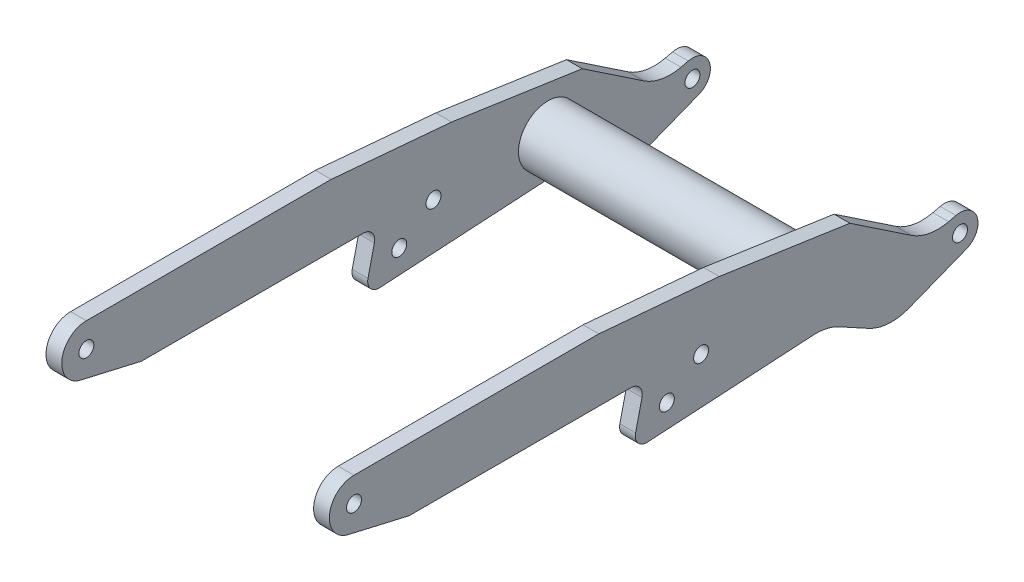
from build123d import *

# Parameters (mm, degrees)
SKETCH1_R           = 0.95
BOSS_EXTRUDE1_DEPTH = 18
SKETCH2_W           = 32
SKETCH2_H           = 82.41
CUT_EXTRUDE1_DEPTH  = 18
SKETCH3_R           = 3.75
BOSS_EXTRUDE2_DEPTH = 34


with BuildPart() as part:
    # Sketch1 → Boss-Extrude1 (new, symmetric)
    with BuildSketch(Plane(origin=(0, 0, 0), x_dir=(0, 0, -1), z_dir=(1, 0, 0))):
        with BuildLine():
            Line((0, 3.13), (31.1, 3.13))
            Line((31.1, 3.13), (46.4, 1.791423448))
            Line((46.4, 1.791423448), (63, -0.645051075))
            Line((63, -0.645051075), (70.82606591, -5.894041546))
            ThreePointArc((70.82606591, -5.894041546), (73.097461385, -6.814738199), (75.547517331, -6.750351941))
            Line((75.547517331, -6.750351941), (76.475855369, -6.531065029))
            ThreePointArc((76.475855369, -6.531065029), (79.176402306, -8.070534767), (77.831396153, -10.873012114))
            Line((77.831396153, -10.873012114), (70.486743317, -13.749263303))
            ThreePointArc((70.486743317, -13.749263303), (67.920640594, -14.150456708), (65.425410054, -13.429579543))
            Line((65.425410054, -13.429579543), (61.610342493, -11.348317948))
            ThreePointArc((61.610342493, -11.348317948), (60.047195579, -10.760330177), (58.382530932, -10.625981737))
            Line((58.382530932, -10.625981737), (37.275936798, -11.874727235))
            ThreePointArc((37.275936798, -11.874727235), (36.082237819, -11.362512436), (35.77777119, -10.099745108))
            Line((35.77777119, -10.099745108), (36.587860094, -6.605922434))
            ThreePointArc((36.587860094, -6.605922434), (36.310540144, -5.376298946), (35.17533219, -4.828409195))
            Line((35.17533219, -4.828409195), (7, -4.828409195))
            Line((7, -4.828409195), (-0.7040968, -3.049778303))
            ThreePointArc((-0.7040968, -3.049778303), (-3.109879908, 0.354326059), (0, 3.13))
        make_face()
        Circle(SKETCH1_R, mode=Mode.SUBTRACT)
        with Locations((77, -8.75)):
            Circle(SKETCH1_R, mode=Mode.SUBTRACT)
        with Locations((39.75, -8.75)):
            Circle(SKETCH1_R, mode=Mode.SUBTRACT)
        with Locations((44.1, -5.6)):
            Circle(SKETCH1_R, mode=Mode.SUBTRACT)
    extrude(amount=BOSS_EXTRUDE1_DEPTH, both=True)

    # Sketch2 → Cut-Extrude1 (cut, symmetric)
    with BuildSketch(Plane(origin=(0, 0, 0), x_dir=(1, 0, 0), z_dir=(0, 1, 0))):
        with Locations((0, 38.075)):
            Rectangle(SKETCH2_W, SKETCH2_H)
    extrude(amount=CUT_EXTRUDE1_DEPTH, both=True, mode=Mode.SUBTRACT)


with BuildPart() as cut_extrude1_piece_1:
    # of the separate pieces the step leaves, piece 1, a body of its own (cut_extrude1_pieces)
    add(part.part.solids().sort_by_distance((16, -4.828409195, -35.17533219))[0])



with BuildPart() as cut_extrude1_piece_2:
    # of the separate pieces the step leaves, piece 2, a body of its own (cut_extrude1_pieces)
    add(part.part.solids().sort_by_distance((-18, -4.828409195, -35.17533219))[0])


with BuildPart() as cut_extrude1_piece_1_1:
    add(cut_extrude1_piece_1.part)

    add(cut_extrude1_piece_2.part)  # Boss-Extrude2 merges Cut-Extrude1 piece 2
    # Sketch3 → Boss-Extrude2 (add)
    with BuildSketch(Plane(origin=(18, 0, 0), x_dir=(0, 0, -1), z_dir=(1, 0, 0))):
        with Locations((58.65, -5.75)):
            Circle(SKETCH3_R)
    extrude(amount=-BOSS_EXTRUDE2_DEPTH)


solid = cut_extrude1_piece_1_1.part
